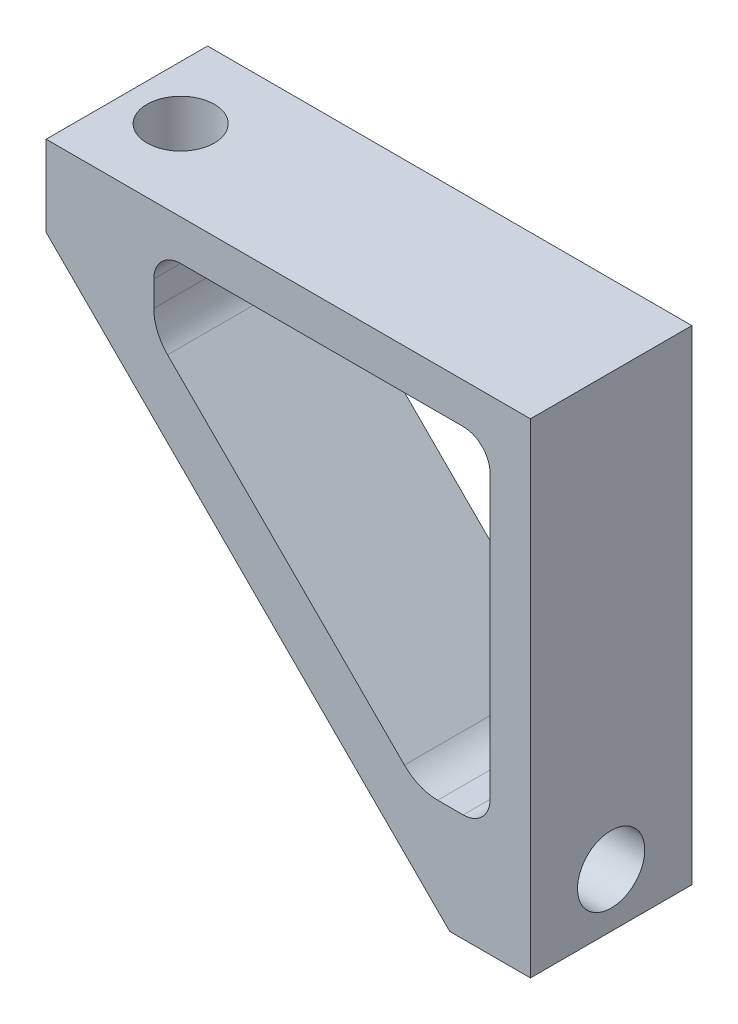
from build123d import *

# Parameters (mm, degrees)
EXTRUDE_1_DEPTH     = 6
CUT_EXTRUDE_1_DEPTH = 27.153393661
SKETCH_3_R          = 1.25
CUT_EXTRUDE_2_DEPTH = 27.153393661
FILLET_1_R          = 1
FILLET_2_R          = 1.75


with BuildPart() as part:
    # 草图1 → 凸台-拉伸1 (new body)
    with BuildSketch(Plane.XY):
        Polygon((-18, 0), (0, 0), (0, -18), (-3, -18), (-18, -3), align=None)
    extrude(amount=EXTRUDE_1_DEPTH)

    # 草图2 → 切除-拉伸1 (cut, through all)
    with BuildSketch(Plane.XY.offset(6)):
        Polygon((-14, -1.5), (-14, -4.171572875), (-4.171572875, -14), (-1.5, -14), (-1.5, -1.5), align=None)
    extrude(amount=-CUT_EXTRUDE_1_DEPTH, mode=Mode.SUBTRACT)

    # 草图3 → 切除-拉伸2 (cut, through all)
    with BuildSketch(Plane(origin=(0, 0, 0), x_dir=(0, 0, -1), z_dir=(1, 0, 0))):
        with Locations(Location((-3, -16, 0), (0, 0, 90))):
            Circle(SKETCH_3_R)
    cut_extrude_2 = extrude(amount=-CUT_EXTRUDE_2_DEPTH, mode=Mode.SUBTRACT)

    # 镜向1: 切除-拉伸2 across plane
    add(cut_extrude_2.mirror(Plane(origin=(0, 0, 0), x_dir=(0, 0, 1), z_dir=(-0.7071067811865476, 0.7071067811865475, 0))), mode=Mode.SUBTRACT)

    # 圆角1
    fillet_1_edges = [part.edges().sort_by_distance(p)[0] for p in [
        (-1.5, -14, 3),
        (-14, -1.5, 3),
        (-1.5, -1.5, 3),
    ]]
    fillet(fillet_1_edges, radius=FILLET_1_R)

    # 圆角2
    fillet_2_edges = [part.edges().sort_by_distance(p)[0] for p in [
        (-4.171572875, -14, 3),
        (-14, -4.171572875, 3),
    ]]
    fillet(fillet_2_edges, radius=FILLET_2_R)


solid = part.part
